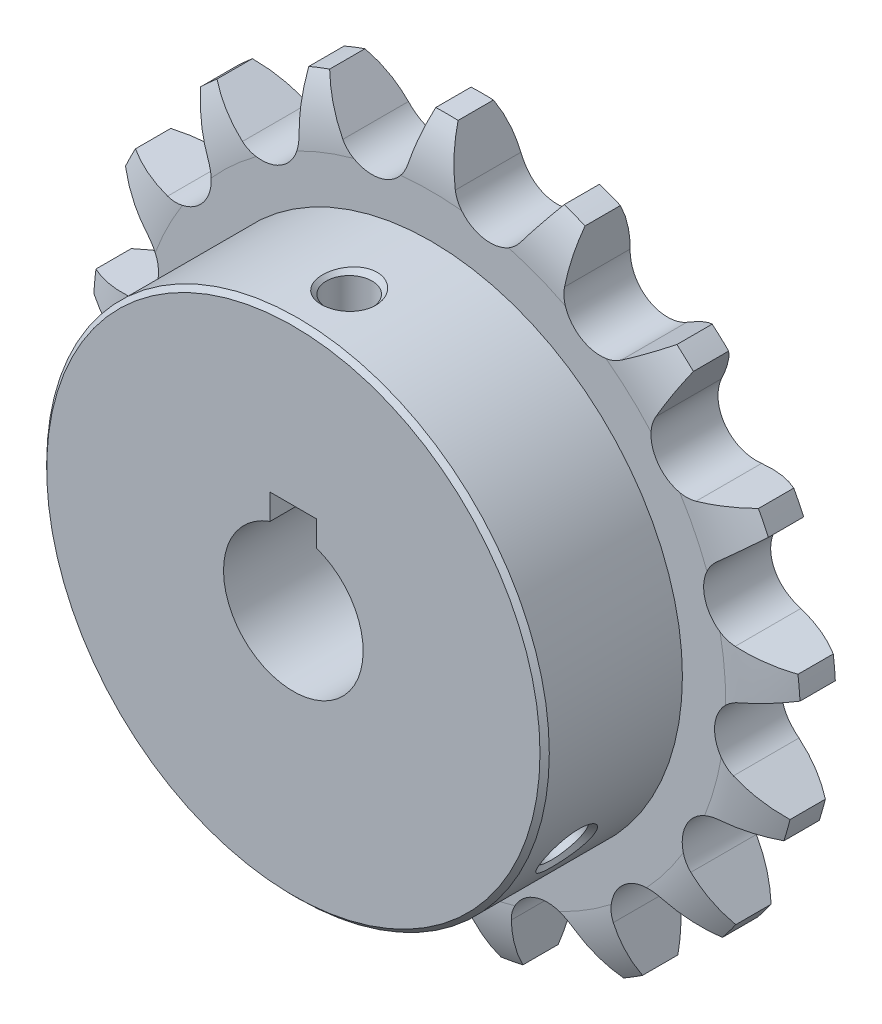
from build123d import *

# Parameters (mm, degrees)
SKETCH2_R          = 69.12
CUT_EXTRUDE1_DEPTH = 7.2
SKETCH5_W          = 5
SKETCH5_H          = 9.8
CUT_EXTRUDE2_DEPTH = 22


with BuildPart() as part:
    # Sketch1 → Revolve1 (revolve)
    with BuildSketch(Plane(origin=(0, 0, 0), x_dir=(0, 0, -1), z_dir=(1, 0, 0)), mode=Mode.PRIVATE) as revolve1_sk:
        with BuildLine():
            Line((-22, 7.5), (0, 7.5))
            Line((0, 7.5), (0, 31.649616664))
            ThreePointArc((0, 31.649616664), (-0.43276813, 34.936816966), (-1.701580086, 38))
            Line((-1.701580086, 38), (-5.498419914, 38))
            ThreePointArc((-5.498419914, 38), (-6.76723187, 34.936816966), (-7.2, 31.649616664))
            Line((-7.2, 31.649616664), (-7.2, 27))
            Line((-7.2, 27), (-21.5, 27))
            Line((-21.5, 27), (-22, 26.5))
            Line((-22, 26.5), (-22, 7.5))
        make_face()
    revolve(revolve1_sk.sketch.rotate(Axis((0, 0, 0), (0, 0, 1)), 270), axis=Axis((0, 0, 0), (0, 0, 1)))

    # Sketch2 → Cut-Extrude1 (cut)
    with BuildSketch(Plane.XY):
        Circle(SKETCH2_R)
        with BuildLine():
            Line((-37.948177074, 2.316104469), (-33.055554163, 0.531433919))
            ThreePointArc((-33.055554163, 0.531433919), (-30.469465795, -2.8234118), (-32.395069811, -6.596327386))
            Line((-32.395069811, -6.596327386), (-36.876454166, -9.249627628))
            Line((-36.876454166, -9.249627628), (-36.222294715, -11.548759617))
            Line((-36.222294715, -11.548759617), (-31.015362359, -11.445496091))
            ThreePointArc((-31.015362359, -11.445496091), (-27.391996715, -13.639593687), (-27.824634673, -17.853341098))
            Line((-27.824634673, -17.853341098), (-31.044918533, -21.946332642))
            Line((-31.044918533, -21.946332642), (-29.60439074, -23.853899723))
            Line((-29.60439074, -23.853899723), (-24.786374006, -21.876648433))
            ThreePointArc((-24.786374006, -21.876648433), (-20.615086696, -22.613672867), (-19.49632844, -26.699162166))
            Line((-19.49632844, -26.699162166), (-21.020594626, -31.679063823))
            Line((-21.020594626, -31.679063823), (-18.988249753, -32.937438492))
            Line((-18.988249753, -32.937438492), (-15.209848498, -29.353238181))
            ThreePointArc((-15.209848498, -29.353238181), (-11.053994985, -28.53365022), (-8.534935019, -31.939113439))
            Line((-8.534935019, -31.939113439), (-8.157322936, -37.133361895))
            Line((-8.157322936, -37.133361895), (-5.807640419, -37.572593681))
            Line((-5.807640419, -37.572593681), (-3.57914867, -32.86551046))
            ThreePointArc((-3.57914867, -32.86551046), (0, -30.6), (3.57914867, -32.86551046))
            Line((3.57914867, -32.86551046), (5.807640419, -37.572593681))
            Line((5.807640419, -37.572593681), (8.157322936, -37.133361895))
            Line((8.157322936, -37.133361895), (8.534935019, -31.939113439))
            ThreePointArc((8.534935019, -31.939113439), (11.053994985, -28.53365022), (15.209848498, -29.353238181))
            Line((15.209848498, -29.353238181), (18.988249753, -32.937438492))
            Line((18.988249753, -32.937438492), (21.020594626, -31.679063823))
            Line((21.020594626, -31.679063823), (19.49632844, -26.699162166))
            ThreePointArc((19.49632844, -26.699162166), (20.615086696, -22.613672867), (24.786374006, -21.876648433))
            Line((24.786374006, -21.876648433), (29.60439074, -23.853899723))
            Line((29.60439074, -23.853899723), (31.044918533, -21.946332642))
            Line((31.044918533, -21.946332642), (27.824634673, -17.853341098))
            ThreePointArc((27.824634673, -17.853341098), (27.391996715, -13.639593687), (31.015362359, -11.445496091))
            Line((31.015362359, -11.445496091), (36.222294715, -11.548759617))
            Line((36.222294715, -11.548759617), (36.876454166, -9.249627628))
            Line((36.876454166, -9.249627628), (32.395069811, -6.596327386))
            ThreePointArc((32.395069811, -6.596327386), (30.469465795, -2.8234118), (33.055554163, 0.531433919))
            Line((33.055554163, 0.531433919), (37.948177074, 2.316104469))
            Line((37.948177074, 2.316104469), (37.727620325, 4.696290851))
            Line((37.727620325, 4.696290851), (32.590371264, 5.551556892))
            ThreePointArc((32.590371264, 5.551556892), (29.431864681, 8.374087496), (30.63141021, 12.436590834))
            Line((30.63141021, 12.436590834), (34.54894784, 15.868165812))
            Line((34.54894784, 15.868165812), (33.483462303, 18.007949227))
            Line((33.483462303, 18.007949227), (28.384162488, 16.949672648))
            ThreePointArc((28.384162488, 16.949672648), (24.419327155, 18.440619873), (24.070324574, 22.662117243))
            Line((24.070324574, 22.662117243), (26.483691759, 27.277143434))
            Line((26.483691759, 27.277143434), (24.717177158, 28.887534274))
            Line((24.717177158, 28.887534274), (20.344515286, 26.058641193))
            ThreePointArc((20.344515286, 26.058641193), (16.108824184, 26.016644353), (14.258408225, 29.826999144))
            Line((14.258408225, 29.826999144), (14.841666354, 35.002191688))
            Line((14.841666354, 35.002191688), (12.612700276, 35.865697747))
            Line((12.612700276, 35.865697747), (9.557228562, 31.648245848))
            ThreePointArc((9.557228562, 31.648245848), (5.622735245, 30.07897685), (2.520814838, 32.963579532))
            Line((2.520814838, 32.963579532), (1.195191668, 38))
            Line((1.195191668, 38), (-1.195191668, 38))
            Line((-1.195191668, 38), (-2.520814838, 32.963579532))
            ThreePointArc((-2.520814838, 32.963579532), (-5.622735245, 30.07897685), (-9.557228562, 31.648245848))
            Line((-9.557228562, 31.648245848), (-12.612700276, 35.865697747))
            Line((-12.612700276, 35.865697747), (-14.841666354, 35.002191688))
            Line((-14.841666354, 35.002191688), (-14.258408225, 29.826999144))
            ThreePointArc((-14.258408225, 29.826999144), (-16.108824184, 26.016644353), (-20.344515286, 26.058641193))
            Line((-20.344515286, 26.058641193), (-24.717177158, 28.887534274))
            Line((-24.717177158, 28.887534274), (-26.483691759, 27.277143434))
            Line((-26.483691759, 27.277143434), (-24.070324574, 22.662117243))
            ThreePointArc((-24.070324574, 22.662117243), (-24.419327155, 18.440619873), (-28.384162488, 16.949672648))
            Line((-28.384162488, 16.949672648), (-33.483462303, 18.007949227))
            Line((-33.483462303, 18.007949227), (-34.54894784, 15.868165812))
            Line((-34.54894784, 15.868165812), (-30.63141021, 12.436590834))
            ThreePointArc((-30.63141021, 12.436590834), (-29.431864681, 8.374087496), (-32.590371264, 5.551556892))
            Line((-32.590371264, 5.551556892), (-37.727620325, 4.696290851))
            Line((-37.727620325, 4.696290851), (-37.948177074, 2.316104469))
        make_face(mode=Mode.SUBTRACT)
    extrude(amount=CUT_EXTRUDE1_DEPTH, mode=Mode.SUBTRACT)

    # Sketch3 → Cut-Revolve1 (revolve, cut)
    with BuildSketch(Plane.XY.offset(16), mode=Mode.PRIVATE) as cut_revolve1_sk:
        Polygon((0, 27), (3, 27), (2.4585, 26.4585), (2.4585, 0), (0, 0), align=None)
    revolve(cut_revolve1_sk.sketch.rotate(Axis((0, 0, 16), (0, 1, 0)), 270), axis=Axis((0, 0, 16), (0, 1, 0)), mode=Mode.SUBTRACT)

    # Sketch4 → Cut-Revolve2 (revolve, cut)
    with BuildSketch(Plane.XY.offset(16), mode=Mode.PRIVATE) as cut_revolve2_sk:
        Polygon((23.382685902, -13.5), (21.882685902, -16.098076211), (21.684483146, -15.358373455), (-1.22925, -2.129123455), (0, 0), align=None)
    revolve(cut_revolve2_sk.sketch.rotate(Axis((0, 0, 16), (0.8660254037844402, -0.4999999999999975, 0)), 180), axis=Axis((0, 0, 16), (0.8660254037844402, -0.4999999999999975, 0)), mode=Mode.SUBTRACT)

    # Sketch5 → Cut-Extrude2 (cut)
    with BuildSketch(Plane.XY):
        with Locations((0, 4.9)):
            Rectangle(SKETCH5_W, SKETCH5_H)
    extrude(amount=CUT_EXTRUDE2_DEPTH, mode=Mode.SUBTRACT)


solid = part.part
